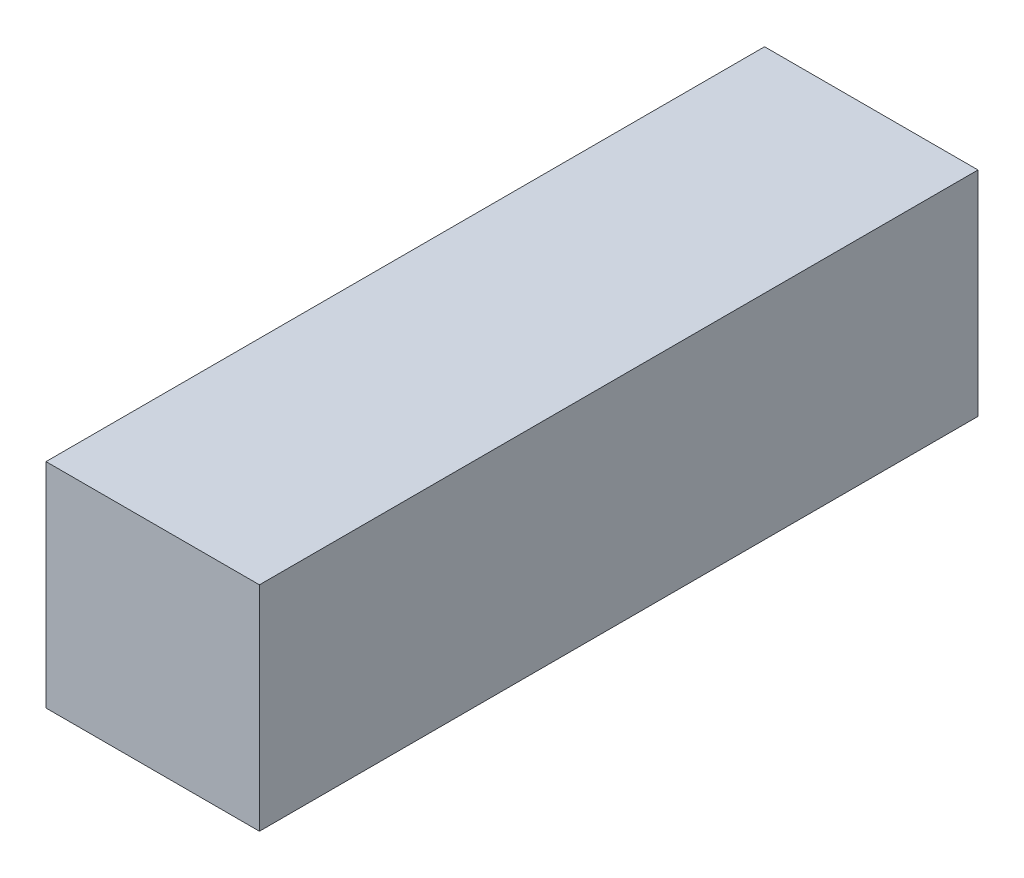
from build123d import *

# Parameters (mm, degrees)
SKETCH1_W           = 30
SKETCH1_H           = 30
BOSS_EXTRUDE1_DEPTH = 101


with BuildPart() as part:
    # Sketch1 → Boss-Extrude1 (new body)
    with BuildSketch(Plane.XY):
        Rectangle(SKETCH1_W, SKETCH1_H)
    extrude(amount=BOSS_EXTRUDE1_DEPTH)


solid = part.part
